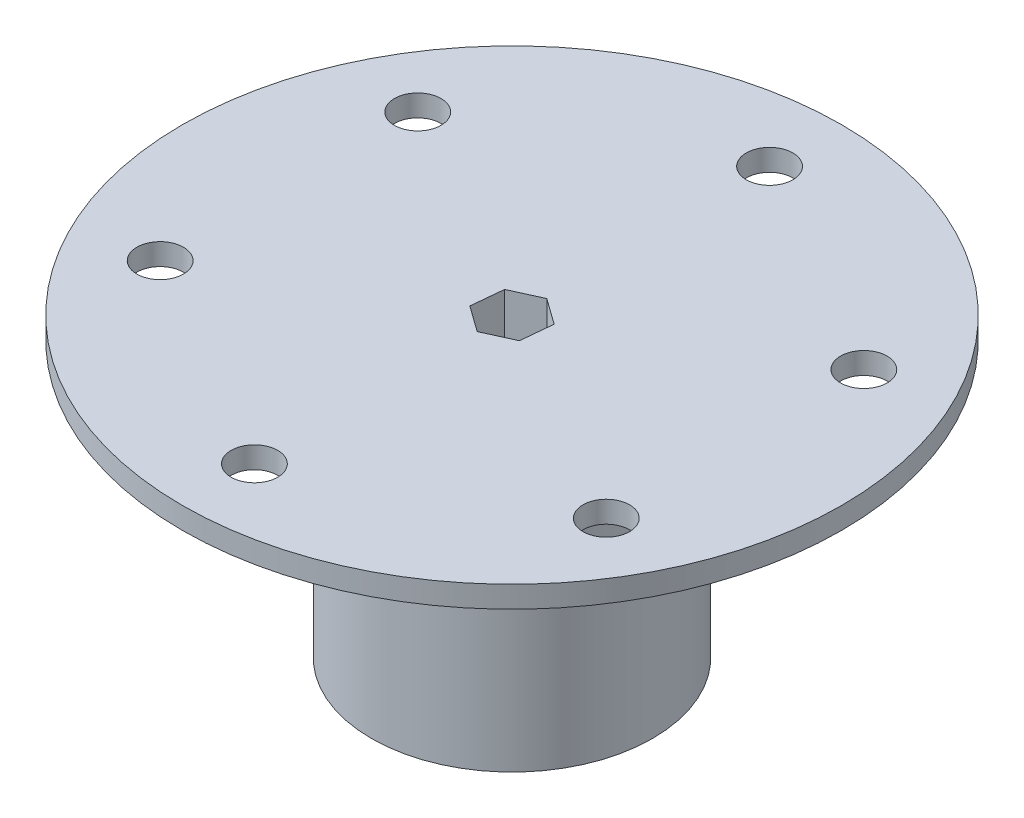
from build123d import *

# Parameters (mm, degrees)
SKETCH1_R           = 30.48
SKETCH1_R_2         = 2.15265
BOSS_EXTRUDE1_DEPTH = 2
CUT_EXTRUDE1_DEPTH  = 10
SKETCH3_R           = 13
BOSS_EXTRUDE2_DEPTH = 25.4


with BuildPart() as part:
    # Sketch1 → Boss-Extrude1 (new body)
    with BuildSketch(Plane(origin=(0, 0, 0), x_dir=(1, 0, 0), z_dir=(0, 1, 0))):
        with Locations(Location((0, 0, 0), (0, 0, 270))):
            Circle(SKETCH1_R)
        with Locations(Location((0, -23.8125, 0), (0, 0, 270))):
            Circle(SKETCH1_R_2, mode=Mode.SUBTRACT)
        with Locations(Location((20.622229928, -11.90625, 0), (0, 0, 270))):
            Circle(SKETCH1_R_2, mode=Mode.SUBTRACT)
        with Locations(Location((20.622229928, 11.90625, 0), (0, 0, 270))):
            Circle(SKETCH1_R_2, mode=Mode.SUBTRACT)
        with Locations(Location((0, 23.8125, 0), (0, 0, 270))):
            Circle(SKETCH1_R_2, mode=Mode.SUBTRACT)
        with Locations(Location((-20.622229928, 11.90625, 0), (0, 0, 270))):
            Circle(SKETCH1_R_2, mode=Mode.SUBTRACT)
        with Locations(Location((-20.622229928, -11.90625, 0), (0, 0, 270))):
            Circle(SKETCH1_R_2, mode=Mode.SUBTRACT)
    extrude(amount=BOSS_EXTRUDE1_DEPTH)

    # Sketch2 → Cut-Extrude1 (cut)
    with BuildSketch(Plane(origin=(0, 2, 0), x_dir=(1, 0, 0), z_dir=(0, 1, 0))):
        Polygon((-2.680603767, -1.218344551), (-0.285184552, -2.930643235), (2.395419215, -1.712298684), (2.680603767, 1.218344551), (0.285184552, 2.930643235), (-2.395419215, 1.712298684), align=None)
    extrude(amount=-CUT_EXTRUDE1_DEPTH, mode=Mode.SUBTRACT)

    # Sketch3 → Boss-Extrude2 (add)
    with BuildSketch(Plane.XZ):
        with Locations(Location((0, 0, 0), (0, 0, 90))):
            Circle(SKETCH3_R)
        Polygon((-0.285184552, 2.930643235), (-2.680603767, 1.218344551), (-2.395419215, -1.712298684), (0.285184552, -2.930643235), (2.680603767, -1.218344551), (2.395419215, 1.712298684), align=None, mode=Mode.SUBTRACT)
    extrude(amount=BOSS_EXTRUDE2_DEPTH)


solid = part.part
